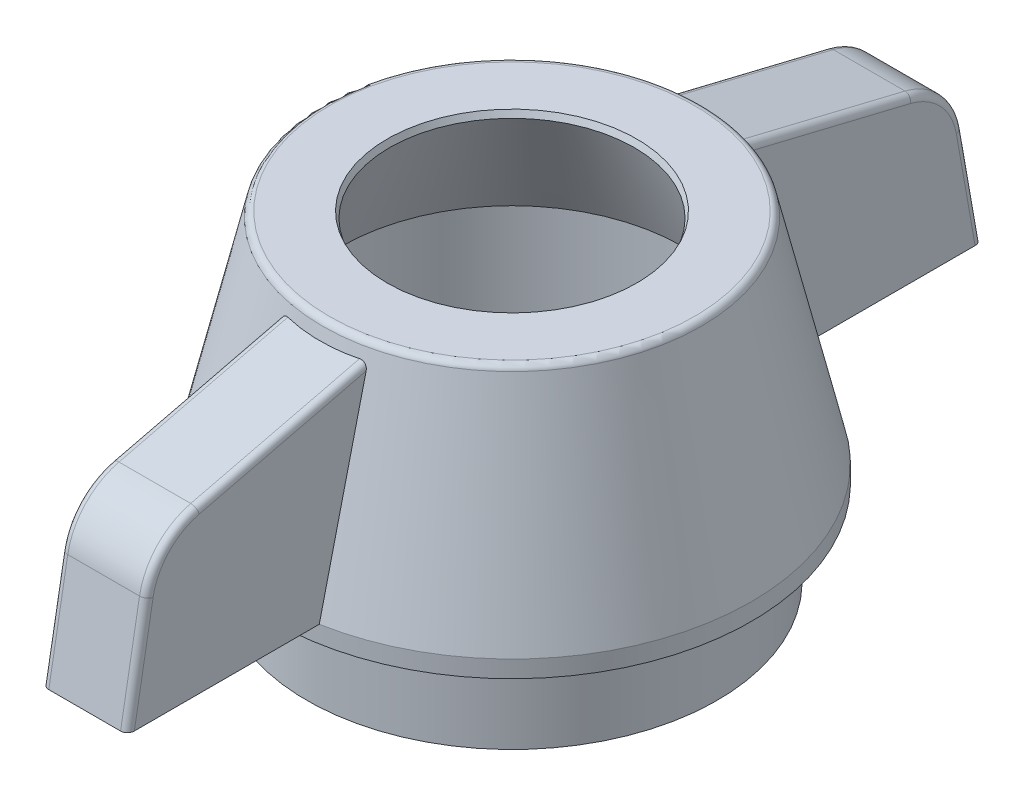
from build123d import *

# Parameters (mm, degrees)
EXTRUDE_1_DEPTH        = 1.25
EXTRUDE_2_DEPTH        = 0.5
FILLET_1_R             = 2
FILLET_1_OF_MIRROR_1_R = 2
FILLET_2_R             = 0.2
CHAMFER_1_SIZE         = 0.2
CHAMFER_1_SIZE2        = 0.15168085


with BuildPart() as part:
    # 草图1 → 旋转1 (revolve)
    with BuildSketch(Plane.XY):
        Polygon((6, 0), (6, 2.5), (7, 2.5), (7, 3), (5.5, 9.4), (3.5, 9.4), (5, 6), (5, 0), align=None)
    revolve(axis=Axis((0, 0, 0), (0, 1, 0)))

    # 草图2 → 凸台-拉伸1 (add, symmetric)
    with BuildSketch(Plane(origin=(0, 0, 0), x_dir=(0, 0, -1), z_dir=(1, 0, 0))):
        Polygon((-7, 3), (-12.5, 3), (-11.7185832, 7.431634889), (-5.614095661, 8.913191845), (-5, 9.062232643), (-5, 3), align=None)
    extrude_1 = extrude(amount=EXTRUDE_1_DEPTH, both=True)

    # 草图3 → 凸台-拉伸2 (add)
    with BuildSketch(Plane.XZ.offset(-3)):
        with BuildLine():
            Line((-0.5, 7.5), (-0.5, 6.982120022))
            ThreePointArc((-0.5, 6.982120022), (0, 7), (0.5, 6.982120022))
            Line((0.5, 6.982120022), (0.5, 7.5))
            ThreePointArc((0.5, 7.5), (0, 8), (-0.5, 7.5))
        make_face()
    extrude_2 = extrude(amount=EXTRUDE_2_DEPTH)

    # 圆角1
    fillet_1_edges = [part.edges().sort_by_distance(p)[0] for p in [
        (0, 7.431634889, 11.7185832),
    ]]
    fillet(fillet_1_edges, radius=FILLET_1_R)

    # 镜向1: 凸台-拉伸1, 凸台-拉伸2 across plane
    add(extrude_1.mirror(Plane.XY))
    add(extrude_2.mirror(Plane.XY))

    # 圆角1 of 镜向1
    fillet_1_of_mirror_1_edges = [part.edges().sort_by_distance(p)[0] for p in [
        (0, 7.431634889, -11.7185832),
    ]]
    fillet(fillet_1_of_mirror_1_edges, radius=FILLET_1_OF_MIRROR_1_R)

    # 圆角2
    fillet_2_edges = [part.edges().sort_by_distance(p)[0] for p in [
        (-1.25, 4.571891442, -12.222833128),
        (-1.25, 7.165047592, -11.434488481),
        (1.25, 4.571891442, -12.222833128),
        (1.25, 7.165047592, -11.434488481),
        (-1.25, 4.571891442, 12.222833128),
        (-1.25, 7.165047592, 11.434488481),
        (1.25, 4.571891442, 12.222833128),
        (1.25, 7.165047592, 11.434488481),
        (-1.25, 8.344789205, -7.956095957),
        (1.25, 8.344789205, -7.956095957),
        (-1.25, 8.344789205, 7.956095957),
        (1.25, 8.344789205, 7.956095957),
        (-5.5, 9.4, 0),
    ]]
    fillet(fillet_2_edges, radius=FILLET_2_R)

    # 倒角1
    chamfer_1_edges = [part.edges().sort_by_distance(p)[0] for p in [
        (-3.5, 9.4, 0),
    ]]
    chamfer_1_side = [part.faces().sort_by_distance(p)[0] for p in [
        (-4.25, 7.7, 0),
    ]]
    chamfer(chamfer_1_edges, length=CHAMFER_1_SIZE, length2=CHAMFER_1_SIZE2, reference=chamfer_1_side[0])


solid = part.part
